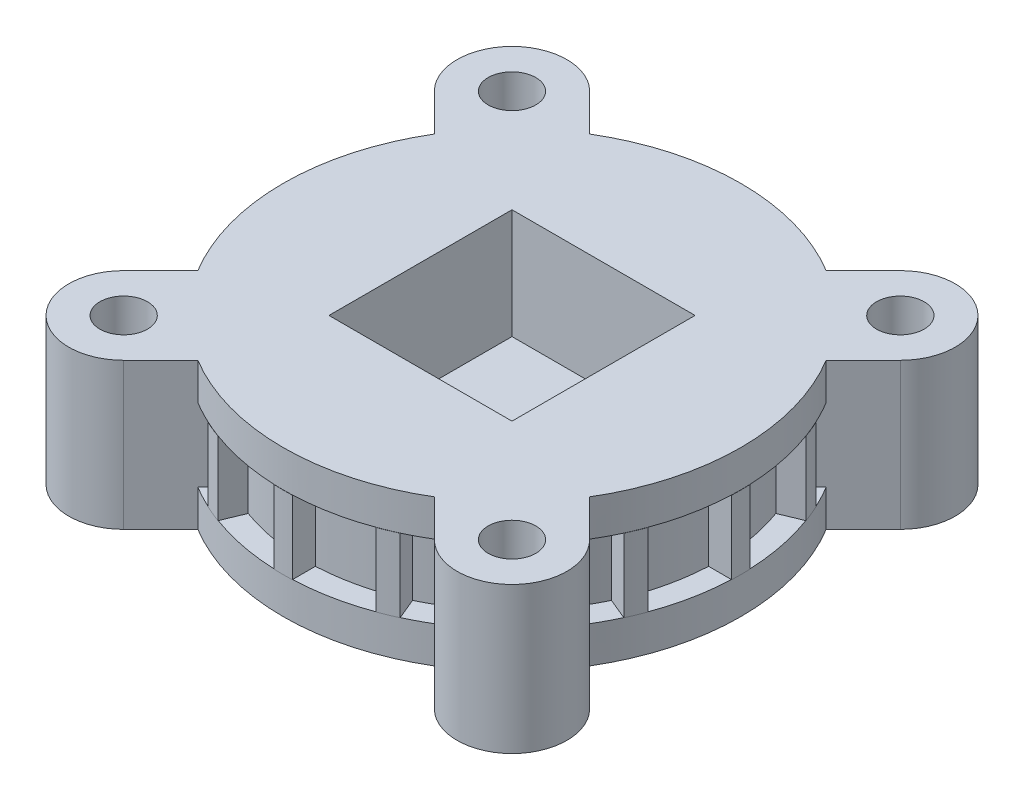
from build123d import *

# Parameters (mm, degrees)
BOSS_EXTRUDE1_DEPTH = 4
BOSS_EXTRUDE2_DEPTH = 8
BOSS_EXTRUDE3_DEPTH = 4
SKETCH4_R           = 2.6
CUT_EXTRUDE1_DEPTH  = 12
SKETCH5_W           = 20
SKETCH5_H           = 20
CUT_EXTRUDE2_DEPTH  = 12


with BuildPart() as part:
    # Sketch1 → Boss-Extrude1 (new body)
    with BuildSketch(Plane(origin=(0, 0, 0), x_dir=(1, 0, 0), z_dir=(0, 1, 0))):
        with BuildLine():
            Line((21.403642989, 12.918361615), (25.455844123, 16.970562748))
            ThreePointArc((25.455844123, 16.970562748), (25.455844123, 25.455844123), (16.970562748, 25.455844123))
            Line((16.970562748, 25.455844123), (12.918361615, 21.403642989))
            ThreePointArc((12.918361615, 21.403642989), (0, 25), (-12.918361615, 21.403642989))
            Line((-12.918361615, 21.403642989), (-16.970562748, 25.455844123))
            ThreePointArc((-16.970562748, 25.455844123), (-25.455844123, 25.455844123), (-25.455844123, 16.970562748))
            Line((-25.455844123, 16.970562748), (-21.403642989, 12.918361615))
            ThreePointArc((-21.403642989, 12.918361615), (-25, 0), (-21.403642989, -12.918361615))
            Line((-21.403642989, -12.918361615), (-25.455844123, -16.970562748))
            ThreePointArc((-25.455844123, -16.970562748), (-25.455844123, -25.455844123), (-16.970562748, -25.455844123))
            Line((-16.970562748, -25.455844123), (-12.918361615, -21.403642989))
            ThreePointArc((-12.918361615, -21.403642989), (0, -25), (12.918361615, -21.403642989))
            Line((12.918361615, -21.403642989), (16.970562748, -25.455844123))
            ThreePointArc((16.970562748, -25.455844123), (25.455844123, -25.455844123), (25.455844123, -16.970562748))
            Line((25.455844123, -16.970562748), (21.403642989, -12.918361615))
            ThreePointArc((21.403642989, -12.918361615), (25, 0), (21.403642989, 12.918361615))
        make_face()
    extrude(amount=BOSS_EXTRUDE1_DEPTH)

    # Sketch2 → Boss-Extrude2 (add)
    with BuildSketch(Plane(origin=(0, 4, 0), x_dir=(1, 0, 0), z_dir=(0, 1, 0))):
        with BuildLine():
            Line((-1, 25), (-1, 22.477766793))
            ThreePointArc((-1, 22.477766793), (-4.389532245, 22.067668809), (-7.677989416, 21.149432109))
            Line((-7.677989416, 21.149432109), (-8.643206277, 23.479671745))
            ThreePointArc((-8.643206277, 23.479671745), (-9.574736419, 23.115458518), (-10.490965342, 22.71430488))
            Line((-10.490965342, 22.71430488), (-9.525748481, 20.384065244))
            ThreePointArc((-9.525748481, 20.384065244), (-10.316353506, 19.995570768), (-11.091145538, 19.576426912))
            Line((-11.091145538, 19.576426912), (-16.970562748, 25.455844123))
            ThreePointArc((-16.970562748, 25.455844123), (-25.455844123, 25.455844123), (-25.455844123, 16.970562748))
            Line((-25.455844123, 16.970562748), (-19.576426912, 11.091145538))
            ThreePointArc((-19.576426912, 11.091145538), (-19.995570768, 10.316353506), (-20.384065244, 9.525748481))
            Line((-20.384065244, 9.525748481), (-22.71430488, 10.490965342))
            ThreePointArc((-22.71430488, 10.490965342), (-23.115458518, 9.574736419), (-23.479671745, 8.643206277))
            Line((-23.479671745, 8.643206277), (-21.149432109, 7.677989416))
            ThreePointArc((-21.149432109, 7.677989416), (-22.067668809, 4.389532245), (-22.477766793, 1))
            Line((-22.477766793, 1), (-25, 1))
            ThreePointArc((-25, 1), (-25.019992006, 0), (-25, -1))
            Line((-25, -1), (-22.477766793, -1))
            ThreePointArc((-22.477766793, -1), (-22.067668809, -4.389532245), (-21.149432109, -7.677989416))
            Line((-21.149432109, -7.677989416), (-23.479671745, -8.643206277))
            ThreePointArc((-23.479671745, -8.643206277), (-23.115458518, -9.574736419), (-22.71430488, -10.490965342))
            Line((-22.71430488, -10.490965342), (-20.384065244, -9.525748481))
            ThreePointArc((-20.384065244, -9.525748481), (-19.995570768, -10.316353506), (-19.576426912, -11.091145538))
            Line((-19.576426912, -11.091145538), (-25.455844123, -16.970562748))
            ThreePointArc((-25.455844123, -16.970562748), (-25.455844123, -25.455844123), (-16.970562748, -25.455844123))
            Line((-16.970562748, -25.455844123), (-11.091145538, -19.576426912))
            ThreePointArc((-11.091145538, -19.576426912), (-10.316353506, -19.995570768), (-9.525748481, -20.384065244))
            Line((-9.525748481, -20.384065244), (-10.490965342, -22.71430488))
            ThreePointArc((-10.490965342, -22.71430488), (-9.574736419, -23.115458518), (-8.643206277, -23.479671745))
            Line((-8.643206277, -23.479671745), (-7.677989416, -21.149432109))
            ThreePointArc((-7.677989416, -21.149432109), (-4.389532245, -22.067668809), (-1, -22.477766793))
            Line((-1, -22.477766793), (-1, -25))
            ThreePointArc((-1, -25), (0, -25.019992006), (1, -25))
            Line((1, -25), (1, -22.477766793))
            ThreePointArc((1, -22.477766793), (4.389532245, -22.067668809), (7.677989416, -21.149432109))
            Line((7.677989416, -21.149432109), (8.643206277, -23.479671745))
            ThreePointArc((8.643206277, -23.479671745), (9.574736419, -23.115458518), (10.490965342, -22.71430488))
            Line((10.490965342, -22.71430488), (9.525748481, -20.384065244))
            ThreePointArc((9.525748481, -20.384065244), (10.316353506, -19.995570768), (11.091145538, -19.576426912))
            Line((11.091145538, -19.576426912), (16.970562748, -25.455844123))
            ThreePointArc((16.970562748, -25.455844123), (25.455844123, -25.455844123), (25.455844123, -16.970562748))
            Line((25.455844123, -16.970562748), (19.576426912, -11.091145538))
            ThreePointArc((19.576426912, -11.091145538), (19.995570768, -10.316353506), (20.384065244, -9.525748481))
            Line((20.384065244, -9.525748481), (22.71430488, -10.490965342))
            ThreePointArc((22.71430488, -10.490965342), (23.115458518, -9.574736419), (23.479671745, -8.643206277))
            Line((23.479671745, -8.643206277), (21.149432109, -7.677989416))
            ThreePointArc((21.149432109, -7.677989416), (22.067668809, -4.389532245), (22.477766793, -1))
            Line((22.477766793, -1), (25, -1))
            ThreePointArc((25, -1), (25.019992006, 0), (25, 1))
            Line((25, 1), (22.477766793, 1))
            ThreePointArc((22.477766793, 1), (22.067668809, 4.389532245), (21.149432109, 7.677989416))
            Line((21.149432109, 7.677989416), (23.479671745, 8.643206277))
            ThreePointArc((23.479671745, 8.643206277), (23.115458518, 9.574736419), (22.71430488, 10.490965342))
            Line((22.71430488, 10.490965342), (20.384065244, 9.525748481))
            ThreePointArc((20.384065244, 9.525748481), (19.995570768, 10.316353506), (19.576426912, 11.091145538))
            Line((19.576426912, 11.091145538), (25.455844123, 16.970562748))
            ThreePointArc((25.455844123, 16.970562748), (25.455844123, 25.455844123), (16.970562748, 25.455844123))
            Line((16.970562748, 25.455844123), (11.091145538, 19.576426912))
            ThreePointArc((11.091145538, 19.576426912), (10.316353506, 19.995570768), (9.525748481, 20.384065244))
            Line((9.525748481, 20.384065244), (10.490965342, 22.71430488))
            ThreePointArc((10.490965342, 22.71430488), (9.574736419, 23.115458518), (8.643206277, 23.479671745))
            Line((8.643206277, 23.479671745), (7.677989416, 21.149432109))
            ThreePointArc((7.677989416, 21.149432109), (4.389532245, 22.067668809), (1, 22.477766793))
            Line((1, 22.477766793), (1, 25))
            ThreePointArc((1, 25), (0, 25.019992006), (-1, 25))
        make_face()
    extrude(amount=BOSS_EXTRUDE2_DEPTH)

    # Sketch3 → Boss-Extrude3 (add)
    with BuildSketch(Plane(origin=(0, 12, 0), x_dir=(1, 0, 0), z_dir=(0, 1, 0))):
        with BuildLine():
            Line((21.403642989, -12.918361615), (25.455844123, -16.970562748))
            ThreePointArc((25.455844123, -16.970562748), (25.455844123, -25.455844123), (16.970562748, -25.455844123))
            Line((16.970562748, -25.455844123), (12.918361615, -21.403642989))
            ThreePointArc((12.918361615, -21.403642989), (0, -25), (-12.918361615, -21.403642989))
            Line((-12.918361615, -21.403642989), (-16.970562748, -25.455844123))
            ThreePointArc((-16.970562748, -25.455844123), (-25.455844123, -25.455844123), (-25.455844123, -16.970562748))
            Line((-25.455844123, -16.970562748), (-21.403642989, -12.918361615))
            ThreePointArc((-21.403642989, -12.918361615), (-25, 0), (-21.403642989, 12.918361615))
            Line((-21.403642989, 12.918361615), (-25.455844123, 16.970562748))
            ThreePointArc((-25.455844123, 16.970562748), (-25.455844123, 25.455844123), (-16.970562748, 25.455844123))
            Line((-16.970562748, 25.455844123), (-12.918361615, 21.403642989))
            ThreePointArc((-12.918361615, 21.403642989), (0, 25), (12.918361615, 21.403642989))
            Line((12.918361615, 21.403642989), (16.970562748, 25.455844123))
            ThreePointArc((16.970562748, 25.455844123), (25.455844123, 25.455844123), (25.455844123, 16.970562748))
            Line((25.455844123, 16.970562748), (21.403642989, 12.918361615))
            ThreePointArc((21.403642989, 12.918361615), (25, 0), (21.403642989, -12.918361615))
        make_face()
    extrude(amount=BOSS_EXTRUDE3_DEPTH)

    # Sketch4 → Cut-Extrude1 (cut)
    with BuildSketch(Plane(origin=(0, 16, 0), x_dir=(1, 0, 0), z_dir=(0, 1, 0))):
        with Locations(Location((-21.213203436, -21.213203436, 0), (0, 0, 270))):
            Circle(SKETCH4_R)
        with Locations(Location((-21.213203436, 21.213203436, 0), (0, 0, 270))):
            Circle(SKETCH4_R)
        with Locations(Location((21.213203436, 21.213203436, 0), (0, 0, 270))):
            Circle(SKETCH4_R)
        with Locations(Location((21.213203436, -21.213203436, 0), (0, 0, 270))):
            Circle(SKETCH4_R)
    extrude(amount=-CUT_EXTRUDE1_DEPTH, mode=Mode.SUBTRACT)

    # Sketch5 → Cut-Extrude2 (cut)
    with BuildSketch(Plane(origin=(0, 16, 0), x_dir=(1, 0, 0), z_dir=(0, 1, 0))):
        Rectangle(SKETCH5_W, SKETCH5_H)
    extrude(amount=-CUT_EXTRUDE2_DEPTH, mode=Mode.SUBTRACT)


solid = part.part
